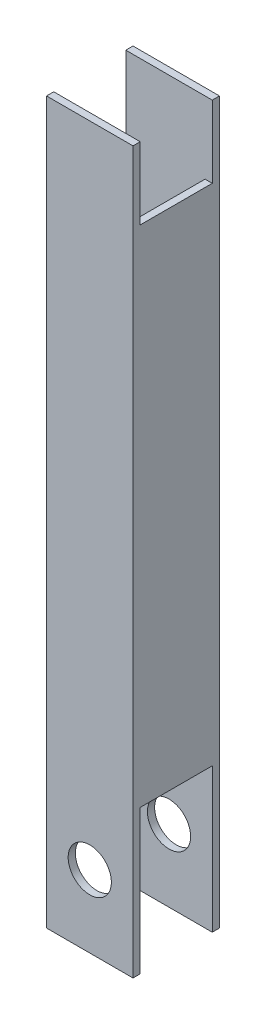
from build123d import *

# Parameters (mm, degrees)
SKETCH2_W               = 60
SKETCH2_H               = 60
BOSS_EXTRUDE1_DEPTH     = 500
SHELL1_T                = -5
SKETCH3_W               = 100
SKETCH3_H               = 50
SKETCH3_W_2             = 50
CUT_EXTRUDE1_DEPTH      = 505.479930225
CUT_EXTRUDE3_DEPTH      = 504.909714135
CUT_EXTRUDE3_DEPTH_BACK = 504.909714135
SKETCH4_R               = 15


with BuildPart() as part:
    # Sketch2 → Boss-Extrude1 (new body)
    with BuildSketch(Plane(origin=(0, 0, 0), x_dir=(-1, 0, 0), z_dir=(0, 1, 0))):
        Rectangle(SKETCH2_W, SKETCH2_H)
    extrude(amount=BOSS_EXTRUDE1_DEPTH)

    # Shell1
    shell1_openings = [part.faces().sort_by_distance(p)[0] for p in [
        (0, 0, 0),
        (0, 500, 0),
    ]]
    offset(amount=SHELL1_T, openings=shell1_openings, kind=Kind.INTERSECTION)

    # Sketch3 → Cut-Extrude1 (cut, through all)
    with BuildSketch(Plane.YZ.offset(30)):
        with Locations((50, 0)):
            Rectangle(SKETCH3_W, SKETCH3_H)
        with Locations((475, 0)):
            Rectangle(SKETCH3_W_2, SKETCH3_H)
    extrude(amount=-CUT_EXTRUDE1_DEPTH, mode=Mode.SUBTRACT)

    # Sketch4 → Cut-Extrude3 (cut, two sides: drawn at the far end of the back side and taken through both)
    with BuildSketch(Plane(origin=(0, 0, 25), x_dir=(1, 0, 0), z_dir=(0, 0, -1)).offset(-CUT_EXTRUDE3_DEPTH_BACK)):
        with Locations((0, -50)):
            Circle(SKETCH4_R)
    extrude(amount=CUT_EXTRUDE3_DEPTH + CUT_EXTRUDE3_DEPTH_BACK, mode=Mode.SUBTRACT)


solid = part.part
